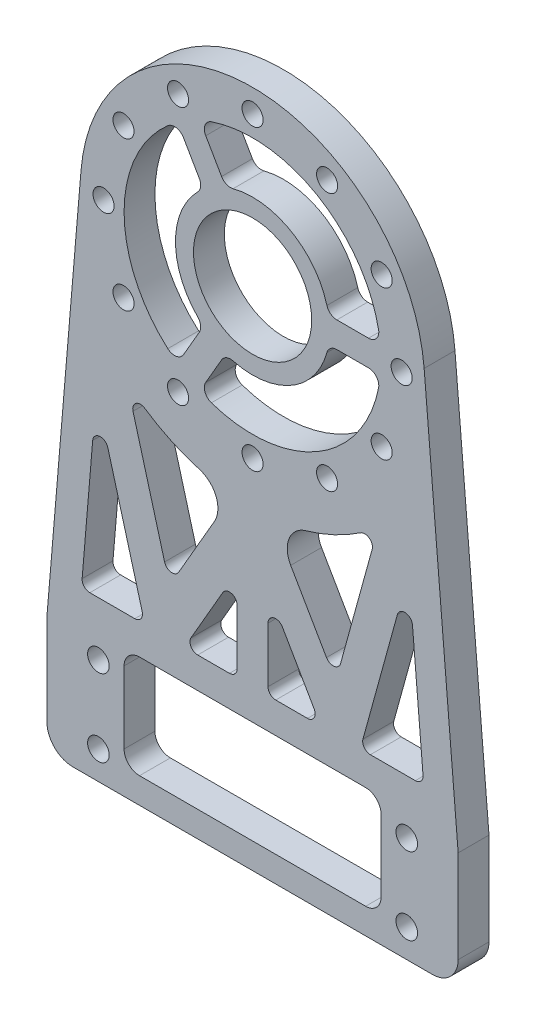
from build123d import *

# Parameters (mm, degrees)
SKETCH_1_R          = 33.5
SKETCH_1_R_2        = 25
SKETCH_1_W          = 80
SKETCH_1_H          = 20
SKETCH_1_R_3        = 2.1
EXTRUDE_1_DEPTH     = 6
SKETCH_3_R          = 2.05
CUT_EXTRUDE_1_DEPTH = 126.686116974
EXTRUDE_2_DEPTH     = 6
FILLET_1_R          = 2
SKETCH_5_W          = 80
SKETCH_5_H          = 3
EXTRUDE_3_DEPTH     = 6
FILLET_2_R          = 5
SKETCH_6_W          = 50
SKETCH_6_H          = 20
CUT_EXTRUDE_2_DEPTH = 10
FILLET_3_R          = 3
FILLET_4_R          = 1.5
FILLET_5_R          = 5


with BuildPart() as part:
    # 草图1 → 凸台-拉伸1 (new body)
    # profile 1 of 3: a face of its own
    with BuildSketch(Plane.XY):
        with Locations((0, 85.5)):
            Circle(SKETCH_1_R)
        with Locations((0, 85.5)):
            Circle(SKETCH_1_R_2, mode=Mode.SUBTRACT)
    # profile 2 of 3: a face of its own
    with BuildSketch(Plane.XY):
        with BuildLine():
            Line((-33.38100662, 88.32106311), (-40, 10))
            Line((-40, 10), (40, 10))
            Line((40, 10), (33.38100662, 88.32106311))
            ThreePointArc((33.38100662, 88.32106311), (33.470238435, 86.911785792), (33.5, 85.5))
            ThreePointArc((33.5, 85.5), (-1.411785792, 52.029761565), (-33.38100662, 88.32106311))
        make_face()
    # profile 3 of 3: a face of its own
    with BuildSketch(Plane.XY):
        Rectangle(SKETCH_1_W, SKETCH_1_H)
        with Locations((-30, 7.5)):
            Circle(SKETCH_1_R_3, mode=Mode.SUBTRACT)
        with Locations((30, 7.5)):
            Circle(SKETCH_1_R_3, mode=Mode.SUBTRACT)
        with Locations((30, -7.5)):
            Circle(SKETCH_1_R_3, mode=Mode.SUBTRACT)
        with Locations((-30, -7.5)):
            Circle(SKETCH_1_R_3, mode=Mode.SUBTRACT)
    extrude(amount=EXTRUDE_1_DEPTH)

    # 草图3 → 切除-拉伸1 (cut, through all)
    with BuildSketch(Plane.XY.offset(6)):
        with Locations((0, 114.5)):
            Circle(SKETCH_3_R)
        with Locations((14.5, 110.61473671)):
            Circle(SKETCH_3_R)
        with Locations((25.11473671, 100)):
            Circle(SKETCH_3_R)
        with Locations((29, 85.5)):
            Circle(SKETCH_3_R)
        with Locations((25.11473671, 71)):
            Circle(SKETCH_3_R)
        with Locations((14.5, 60.38526329)):
            Circle(SKETCH_3_R)
        with Locations((0, 56.5)):
            Circle(SKETCH_3_R)
        with Locations((-14.5, 60.38526329)):
            Circle(SKETCH_3_R)
        with Locations((-25.11473671, 71)):
            Circle(SKETCH_3_R)
        with Locations((-29, 85.5)):
            Circle(SKETCH_3_R)
        with Locations((-25.11473671, 100)):
            Circle(SKETCH_3_R)
        with Locations((-14.5, 110.61473671)):
            Circle(SKETCH_3_R)
    extrude(amount=-CUT_EXTRUDE_1_DEPTH, mode=Mode.SUBTRACT)


with BuildPart() as body_2:
    # 草图4 → 凸台-拉伸2 (new body)
    with BuildSketch(Plane.XY.offset(6)):
        with BuildLine():
            ThreePointArc((-10.272279454, 108.292109925), (-12.5, 107.150635095), (-14.602406473, 105.792109925))
            Line((-14.602406473, 105.792109925), (-9.560163238, 97.058688457))
            Line((-9.560163238, 97.058688457), (-7.77754959, 93.971111048))
            ThreePointArc((-7.77754959, 93.971111048), (-5.75, 95.459292144), (-3.447422571, 96.471111048))
            Line((-3.447422571, 96.471111048), (-5.230036219, 99.558688457))
            Line((-5.230036219, 99.558688457), (-10.272279454, 108.292109925))
        make_face()
        with BuildLine():
            ThreePointArc((25, 85.5), (24.968651828, 86.751569376), (24.874685928, 88))
            Line((24.874685928, 88), (14.790199458, 88))
            Line((14.790199458, 88), (11.22497216, 88))
            ThreePointArc((11.22497216, 88), (11.431036258, 86.757541283), (11.5, 85.5))
            ThreePointArc((11.5, 85.5), (11.431036258, 84.242458717), (11.22497216, 83))
            Line((11.22497216, 83), (14.790199458, 83))
            Line((14.790199458, 83), (24.874685928, 83))
            ThreePointArc((24.874685928, 83), (24.968651828, 84.248430624), (25, 85.5))
        make_face()
        with BuildLine():
            Line((-9.560163238, 73.941311543), (-14.602406473, 65.207890075))
            ThreePointArc((-14.602406473, 65.207890075), (-12.5, 63.849364905), (-10.272279454, 62.707890075))
            Line((-10.272279454, 62.707890075), (-5.230036219, 71.441311543))
            Line((-5.230036219, 71.441311543), (-3.447422571, 74.528888952))
            ThreePointArc((-3.447422571, 74.528888952), (-5.75, 75.540707856), (-7.77754959, 77.028888952))
            Line((-7.77754959, 77.028888952), (-9.560163238, 73.941311543))
        make_face()
        with BuildLine():
            Line((-7.77754959, 93.971111048), (-9.560163238, 97.058688457))
            ThreePointArc((-9.560163238, 97.058688457), (-15, 85.5), (-9.560163238, 73.941311543))
            Line((-9.560163238, 73.941311543), (-7.77754959, 77.028888952))
            ThreePointArc((-7.77754959, 77.028888952), (-11.5, 85.5), (-7.77754959, 93.971111048))
        make_face()
        with BuildLine():
            Line((-3.447422571, 74.528888952), (-5.230036219, 71.441311543))
            ThreePointArc((-5.230036219, 71.441311543), (7.5, 72.509618943), (14.790199458, 83))
            Line((14.790199458, 83), (11.22497216, 83))
            ThreePointArc((11.22497216, 83), (5.75, 75.540707856), (-3.447422571, 74.528888952))
        make_face()
        with BuildLine():
            ThreePointArc((14.790199458, 88), (7.5, 98.490381057), (-5.230036219, 99.558688457))
            Line((-5.230036219, 99.558688457), (-3.447422571, 96.471111048))
            ThreePointArc((-3.447422571, 96.471111048), (5.75, 95.459292144), (11.22497216, 88))
            Line((11.22497216, 88), (14.790199458, 88))
        make_face()
    extrude(amount=-EXTRUDE_2_DEPTH)

    # Combine 1: union part
    add(part.part)

    # 圆角1
    fillet_1_edges = [body_2.edges().sort_by_distance(p)[0] for p in [
        (-9.560163238, 73.941311543, 3),
        (-14.602406473, 65.207890075, 3),
        (-10.272279454, 62.707890075, 3),
        (-5.230036219, 71.441311543, 3),
        (14.790199458, 83, 3),
        (24.874685928, 83, 3),
        (24.874685928, 88, 3),
        (14.790199458, 88, 3),
        (-5.230036219, 99.558688457, 3),
        (-10.272279454, 108.292109925, 3),
        (-14.602406473, 105.792109925, 3),
        (-9.560163238, 97.058688457, 3),
    ]]
    fillet(fillet_1_edges, radius=FILLET_1_R)

    # 草图5 → 凸台-拉伸3 (add)
    with BuildSketch(Plane.XY.offset(6)):
        with Locations((0, -11.5)):
            Rectangle(SKETCH_5_W, SKETCH_5_H)
    extrude(amount=-EXTRUDE_3_DEPTH)

    # 圆角2
    fillet_2_edges = [body_2.edges().sort_by_distance(p)[0] for p in [
        (-40, -13, 3),
        (40, -13, 3),
    ]]
    fillet(fillet_2_edges, radius=FILLET_2_R)

    # 草图6 → 切除-拉伸2 (cut)
    with BuildSketch(Plane(origin=(0, 0, 0), x_dir=(-1, 0, 0), z_dir=(0, 0, -1))):
        with Locations((0, 2)):
            Rectangle(SKETCH_6_W, SKETCH_6_H)
        Polygon((-33.302523575, 18), (-20.950767875, 18), (-30.401818232, 52.323395297), align=None)
        with BuildLine():
            Line((-16.167580049, 26.996929919), (-3.922674029, 48.205729281))
            ThreePointArc((-3.922674029, 48.205729281), (-14.860033774, 51.069934705), (-24.446601804, 57.063866996))
            Line((-24.446601804, 57.063866996), (-16.167580049, 26.996929919))
        make_face()
        with BuildLine():
            ThreePointArc((24.446601804, 57.063866996), (14.860033774, 51.069934705), (3.922674029, 48.205729281))
            Line((3.922674029, 48.205729281), (16.167580049, 26.996929919))
            Line((16.167580049, 26.996929919), (24.446601804, 57.063866996))
        make_face()
        Polygon((30.401818232, 52.323395297), (20.950767875, 18), (33.302523575, 18), align=None)
        Polygon((-13.279056191, 18), (-3, 18), (-3, 35.803847577), align=None)
        Polygon((3, 35.803847577), (3, 18), (13.279056191, 18), align=None)
    extrude(amount=-CUT_EXTRUDE_2_DEPTH, mode=Mode.SUBTRACT)

    # 圆角3
    fillet_3_edges = [body_2.edges().sort_by_distance(p)[0] for p in [
        (-25, 12, 3),
        (-25, -8, 3),
        (25, -8, 3),
        (25, 12, 3),
    ]]
    fillet(fillet_3_edges, radius=FILLET_3_R)

    # 圆角4
    fillet_4_edges = [body_2.edges().sort_by_distance(p)[0] for p in [
        (-3, 35.803847577, 3),
        (-13.279056191, 18, 3),
        (-3, 18, 3),
        (3, 35.803847577, 3),
        (3, 18, 3),
        (13.279056191, 18, 3),
        (-24.446601804, 57.063866996, 3),
        (-16.167580049, 26.996929919, 3),
        (-20.950767875, 18, 3),
        (-30.401818232, 52.323395297, 3),
        (-33.302523575, 18, 3),
        (20.950767875, 18, 3),
        (33.302523575, 18, 3),
        (30.401818232, 52.323395297, 3),
        (24.446601804, 57.063866996, 3),
        (16.167580049, 26.996929919, 3),
    ]]
    fillet(fillet_4_edges, radius=FILLET_4_R)

    # 圆角5
    fillet_5_edges = [body_2.edges().sort_by_distance(p)[0] for p in [
        (-3.922674029, 48.205729281, 3),
        (3.922674029, 48.205729281, 3),
    ]]
    fillet(fillet_5_edges, radius=FILLET_5_R)


solid = body_2.part
